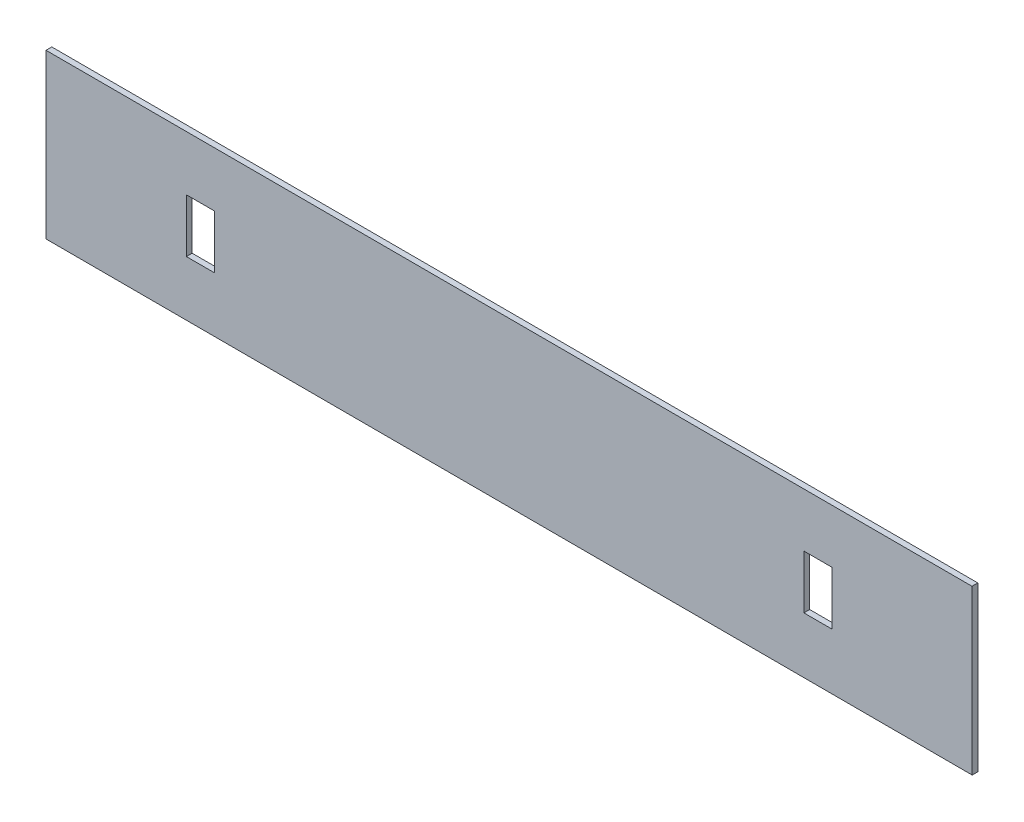
from build123d import *

# Parameters (mm, degrees)
SKETCH1_W           = 14.51987794
SKETCH1_H           = 27.697484205
BOSS_EXTRUDE1_DEPTH = 3


with BuildPart() as part:
    # Sketch1 → Boss-Extrude1 (new body)
    with BuildSketch(Plane.XY):
        Polygon((10.672922398, 975.073069212), (10.566207631, 1059.617843106), (489.608405369, 1059.006658046), (489.715120136, 974.461884152), align=None)
        with Locations((90.428871138, 1017.342955032)):
            Rectangle(SKETCH1_W, SKETCH1_H, mode=Mode.SUBTRACT)
        Polygon((402.675989281, 1031.301508945), (417.19585566, 1031.283185961), (417.160903536, 1003.585723809), (402.641037157, 1003.604046793), align=None, mode=Mode.SUBTRACT)
    extrude(amount=BOSS_EXTRUDE1_DEPTH)


solid = part.part
